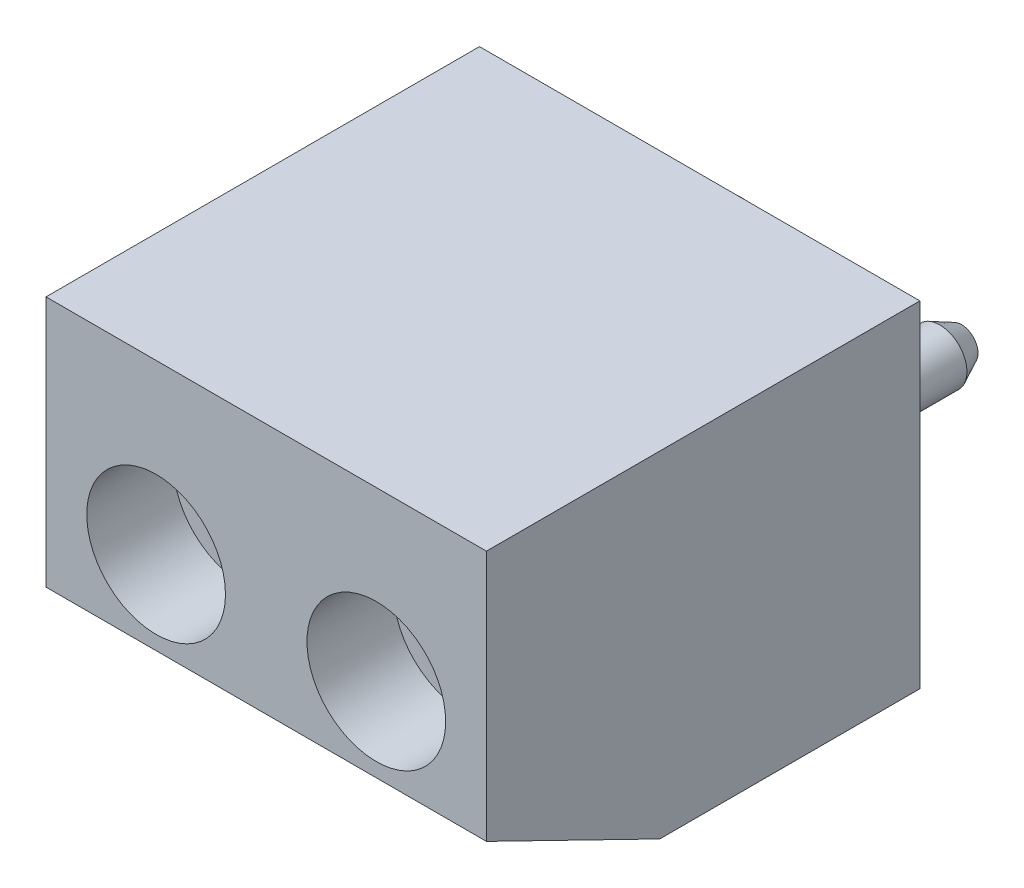
from build123d import *
from OCP.BRepFilletAPI import BRepFilletAPI_MakeChamfer

# Parameters (mm, degrees)
SKETCH1_W           = 10.16
SKETCH1_H           = 7.75
BOSS_EXTRUDE1_DEPTH = 10
CHAMFER1_SIZE       = 4
CHAMFER1_SIZE2      = 1.950930354
SKETCH2_R           = 1.6
CUT_EXTRUDE1_DEPTH  = 2
SKETCH3_W           = 4.58
SKETCH3_H           = 5.5
CUT_EXTRUDE2_DEPTH  = 1
SKETCH4_R           = 1.9
CUT_EXTRUDE3_DEPTH  = 5
SKETCH5_R           = 0.625
BOSS_EXTRUDE2_DEPTH = 3.5
CHAMFER2_SIZE       = 0.5
CHAMFER2_SIZE2      = 0.243866294


with BuildPart() as part:
    # Sketch1 → Boss-Extrude1 (new body)
    with BuildSketch(Plane.XY):
        Rectangle(SKETCH1_W, SKETCH1_H)
    extrude(amount=BOSS_EXTRUDE1_DEPTH)

    # Chamfer1
    chamfer1_edges = [part.edges().sort_by_distance(p)[0] for p in [
        (0, -3.875, 10),
    ]]
    chamfer1_side = [part.faces().sort_by_distance(p)[0] for p in [
        (0, -3.875, 5),
    ]]
    chamfer(chamfer1_edges, length=CHAMFER1_SIZE, length2=CHAMFER1_SIZE2, reference=chamfer1_side[0])

    # Sketch2 → Cut-Extrude1 (cut)
    with BuildSketch(Plane.XY.offset(10)):
        with Locations((-2.54, 0)):
            Circle(SKETCH2_R)
        with Locations((2.54, 0)):
            Circle(SKETCH2_R)
    extrude(amount=-CUT_EXTRUDE1_DEPTH, mode=Mode.SUBTRACT)

    # Sketch3 → Cut-Extrude2 (cut)
    with BuildSketch(Plane.XZ.offset(3.875)):
        with Locations((-2.54, 3)):
            Rectangle(SKETCH3_W, SKETCH3_H)
        with Locations((2.54, 3)):
            Rectangle(SKETCH3_W, SKETCH3_H)
    extrude(amount=-CUT_EXTRUDE2_DEPTH, mode=Mode.SUBTRACT)

    # Sketch4 → Cut-Extrude3 (cut)
    with BuildSketch(Plane.XZ.offset(2.875)):
        with Locations((-2.54, 2.5)):
            Circle(SKETCH4_R)
        with Locations((2.54, 2.5)):
            Circle(SKETCH4_R)
    extrude(amount=-CUT_EXTRUDE3_DEPTH, mode=Mode.SUBTRACT)

    # Sketch5 → Boss-Extrude2 (add)
    with BuildSketch(Plane(origin=(0, 0, 0), x_dir=(-1, 0, 0), z_dir=(0, 0, -1))):
        with Locations((2.54, 0)):
            Circle(SKETCH5_R)
        with Locations((-2.54, 0)):
            Circle(SKETCH5_R)
    extrude(amount=BOSS_EXTRUDE2_DEPTH)

    # Chamfer2: one chamfer whose edges measure the first distance from different faces: ONE call of the kernel's chamfer builder (chamfer() names one face for all edges)
    chamfer2_edges_1 = [part.edges().sort_by_distance(p)[0] for p in [
        (-1.915, 0, -3.5),
    ]]
    chamfer2_side_1 = [part.faces().sort_by_distance(p)[0] for p in [
        (-1.915, 0, -1.75),
    ]]
    chamfer2_edges_2 = [part.edges().sort_by_distance(p)[0] for p in [
        (3.165, 0, -3.5),
    ]]
    chamfer2_side_2 = [part.faces().sort_by_distance(p)[0] for p in [
        (3.165, 0, -1.75),
    ]]
    chamfer2 = BRepFilletAPI_MakeChamfer(part.part.solid().wrapped)
    for e in chamfer2_edges_1:
        chamfer2.Add(CHAMFER2_SIZE, CHAMFER2_SIZE2, e.wrapped, chamfer2_side_1[0].wrapped)  # the first distance lies on this face
    for e in chamfer2_edges_2:
        chamfer2.Add(CHAMFER2_SIZE, CHAMFER2_SIZE2, e.wrapped, chamfer2_side_2[0].wrapped)  # the first distance lies on this face
    add(Compound.cast(chamfer2.Shape()), mode=Mode.REPLACE)


solid = part.part
